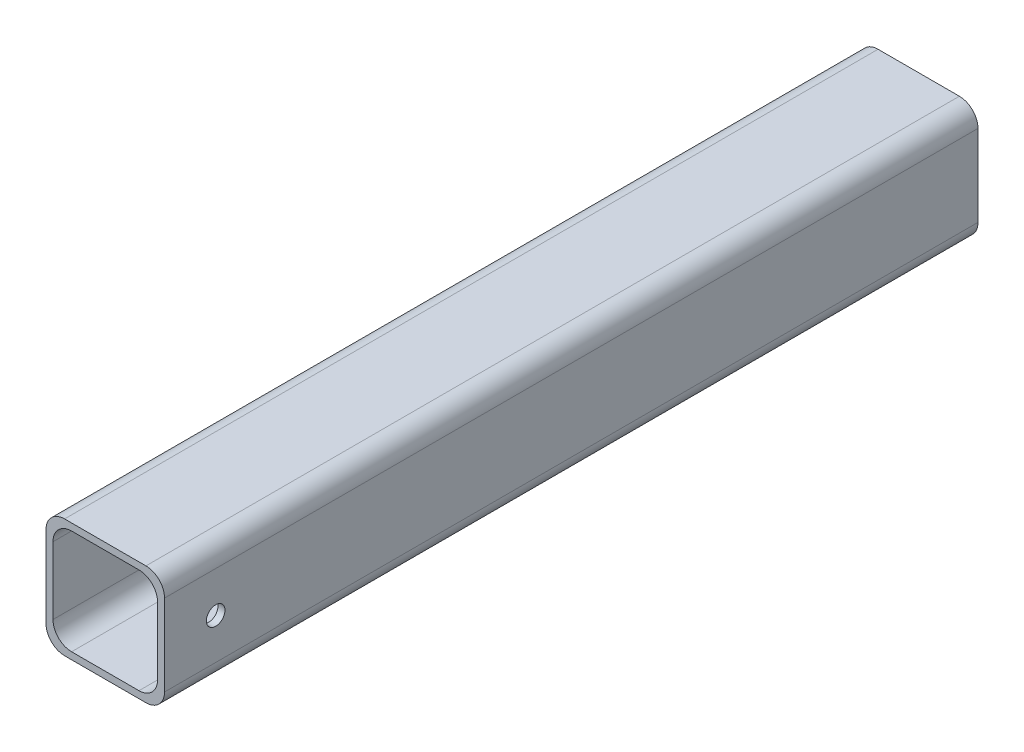
from build123d import *

# Parameters (mm, degrees)
SKETCH4_W           = 25.5
SKETCH4_H           = 25.5
SKETCH4_W_2         = 22.5
SKETCH4_H_2         = 22.5
BOSS_EXTRUDE1_DEPTH = 175
SKETCH5_R           = 2
CUT_EXTRUDE1_DEPTH  = 1.5
FILLET1_R           = 4


with BuildPart() as part:
    # Sketch4 → Boss-Extrude1 (new body)
    with BuildSketch(Plane.XY):
        with Locations((12.75, 12.75)):
            Rectangle(SKETCH4_W, SKETCH4_H)
        with Locations((12.75, 12.75)):
            Rectangle(SKETCH4_W_2, SKETCH4_H_2, mode=Mode.SUBTRACT)
    extrude(amount=BOSS_EXTRUDE1_DEPTH)

    # Sketch5 → Cut-Extrude1 (cut)
    with BuildSketch(Plane(origin=(25.5, 0, 0), x_dir=(0, 0, -1), z_dir=(1, 0, 0))):
        with Locations((-164, 12.75)):
            Circle(SKETCH5_R)
    extrude(amount=-CUT_EXTRUDE1_DEPTH, mode=Mode.SUBTRACT)

    # Fillet1
    fillet1_edges = [part.edges().sort_by_distance(p)[0] for p in [
        (1.5, 1.5, 87.5),
        (24, 1.5, 87.5),
        (24, 24, 87.5),
        (1.5, 24, 87.5),
        (0, 25.5, 87.5),
        (25.5, 25.5, 87.5),
        (25.5, 0, 87.5),
        (0, 0, 87.5),
    ]]
    fillet(fillet1_edges, radius=FILLET1_R)


solid = part.part
